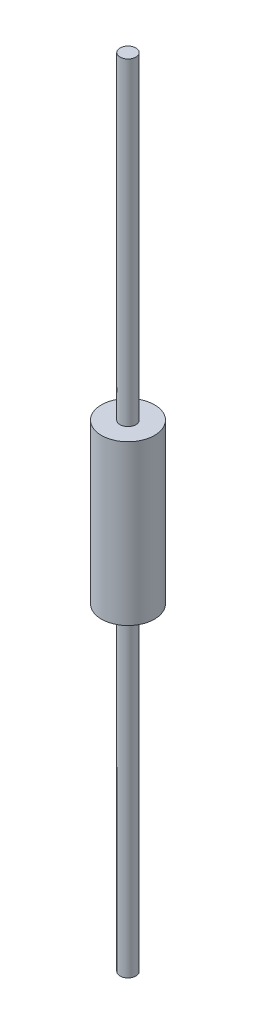
from build123d import *

# Parameters (mm, degrees)
SKETCH1_R           = 0.5
BOSS_EXTRUDE1_DEPTH = 3
SKETCH2_R           = 0.15
BOSS_EXTRUDE2_DEPTH = 6
BOSS_EXTRUDE3_START = 6
SKETCH3_R           = 0.15
BOSS_EXTRUDE3_DEPTH = 6


with BuildPart() as part:
    # Sketch1 → Boss-Extrude1 (new body)
    with BuildSketch(Plane(origin=(0, 0, 0), x_dir=(1, 0, 0), z_dir=(0, 1, 0))):
        with Locations(Location((0, 0, 0), (0, 0, 270))):
            Circle(SKETCH1_R)
    extrude(amount=BOSS_EXTRUDE1_DEPTH)

    # Sketch2 → Boss-Extrude2 (add)
    with BuildSketch(Plane(origin=(0, 3, 0), x_dir=(1, 0, 0), z_dir=(0, 1, 0))):
        with Locations(Location((0, 0, 0), (0, 0, 270))):
            Circle(SKETCH2_R)
    extrude(amount=BOSS_EXTRUDE2_DEPTH)

    # Sketch3 → Boss-Extrude3 (add)
    with BuildSketch(Plane.XZ.offset(BOSS_EXTRUDE3_START)):
        with Locations(Location((0, 0, 0), (0, 0, 90))):
            Circle(SKETCH3_R)
    extrude(amount=-BOSS_EXTRUDE3_DEPTH)


solid = part.part
